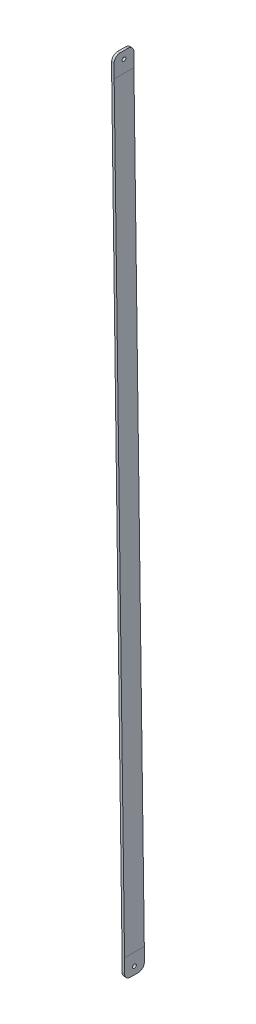
from build123d import *

# Parameters (mm, degrees)
BOSS_EXTRUDE1_DEPTH     = 12.7
FILLET1_R               = 7.62
CUT_EXTRUDE1_DEPTH      = 1023.515835929
CUT_EXTRUDE1_DEPTH_BACK = 1023.515835929
SKETCH2_R               = 2.413


with BuildPart() as part:
    # Sketch1 → Boss-Extrude1 (new, symmetric)
    with BuildSketch(Plane.XY):
        Polygon((0, 0), (3.175, 0), (3.175, 25.4), (-10.16, 996.95), (-10.16, 1022.35), (-13.335, 1022.35), (-13.335, 996.95), (0, 25.4), align=None)
    extrude(amount=BOSS_EXTRUDE1_DEPTH, both=True)

    # Fillet1
    fillet1_edges = [part.edges().sort_by_distance(p)[0] for p in [
        (1.5875, 0, -12.7),
        (-11.7475, 1022.35, 12.7),
        (1.5875, 0, 12.7),
        (-11.7475, 1022.35, -12.7),
    ]]
    fillet(fillet1_edges, radius=FILLET1_R)

    # Sketch2 → Cut-Extrude1 (cut, two sides: drawn at the far end of the back side and taken through both)
    with BuildSketch(Plane(origin=(-10.16, 0, 0), x_dir=(0, 0, -1), z_dir=(1, 0, 0)).offset(-CUT_EXTRUDE1_DEPTH_BACK)):
        with Locations((0, 1012.698)):
            Circle(SKETCH2_R)
        with Locations((0, 9.652)):
            Circle(SKETCH2_R)
    extrude(amount=CUT_EXTRUDE1_DEPTH + CUT_EXTRUDE1_DEPTH_BACK, mode=Mode.SUBTRACT)


solid = part.part
